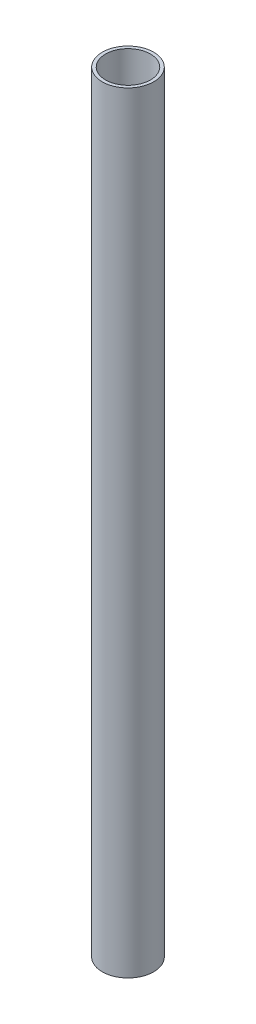
from build123d import *

# Parameters (mm, degrees)
SKETCH1_R           = 8
SKETCH1_R_2         = 7
BOSS_EXTRUDE2_DEPTH = 120


with BuildPart() as part:
    # Sketch1 → Boss-Extrude2 (new, symmetric)
    with BuildSketch(Plane(origin=(0, 0, 0), x_dir=(1, 0, 0), z_dir=(0, 1, 0))):
        Circle(SKETCH1_R)
        Circle(SKETCH1_R_2, mode=Mode.SUBTRACT)
    extrude(amount=BOSS_EXTRUDE2_DEPTH, both=True)


solid = part.part
